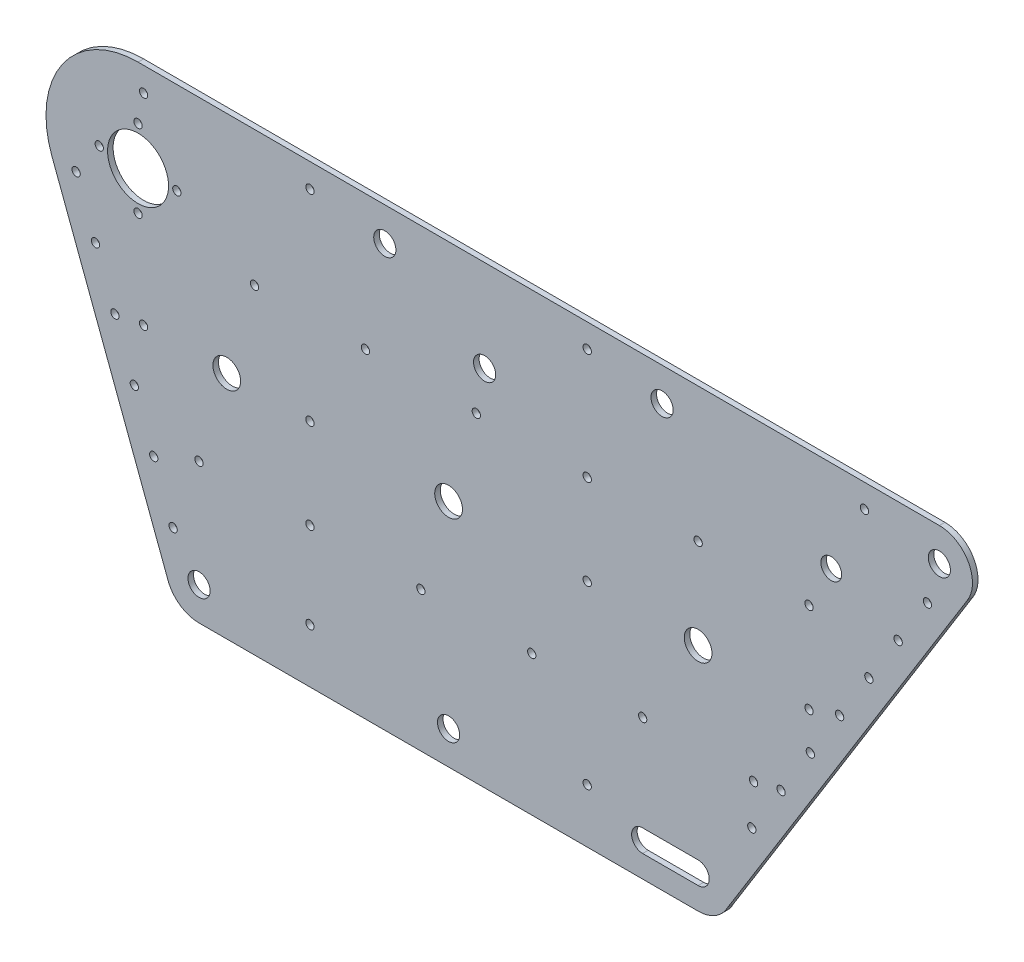
from build123d import *

# Parameters (mm, degrees)
SKETCH2_R             = 3.9998
SKETCH2_R_2           = 1.499925
SKETCH2_R_3           = 4.99975
SKETCH2_R_4           = 3.7498125
SKETCH2_R_5           = 1.5
SKETCH2_R_6           = 10.99945
BOSS_EXTRUDE1_DEPTH   = 1
BODY_MOVE_COPY1_ANGLE = 180


with BuildPart() as part:
    # Sketch2 → Boss-Extrude1 (new, symmetric)
    with BuildSketch(Plane.XY):
        with BuildLine():
            Line((96.362607148, 83.91244893), (182.746139217, -55.124360407))
            ThreePointArc((182.746139217, -55.124360407), (183.120738534, -67.267781048), (172.665833933, -73.456315551))
            Line((172.665833933, -73.456315551), (-116.301106221, -73.709344442))
            ThreePointArc((-116.301106221, -73.709344442), (-143.610306979, -59.428306601), (-147.408355202, -28.84538134))
            Line((-147.408355202, -28.84538134), (-105.239440592, 83.486872373))
            ThreePointArc((-105.239440592, 83.486872373), (-100.811651195, 88.586021375), (-94.331273913, 90.486376541))
            Line((-94.331273913, 90.486376541), (85.638662445, 90.486376541))
            ThreePointArc((85.638662445, 90.486376541), (91.93104468, 88.717175744), (96.362607148, 83.91244893))
        make_face()
        with Locations((-94.331273913, 78.486872372)):
            Circle(SKETCH2_R, mode=Mode.SUBTRACT)
        with Locations((-4.335773913, 78.486872372)):
            Circle(SKETCH2_R, mode=Mode.SUBTRACT)
        with Locations((-54.333273913, 70.986872372)):
            Circle(SKETCH2_R_2, mode=Mode.SUBTRACT)
        with Locations((-103.671855402, 65.368244598)):
            Circle(SKETCH2_R_2, mode=Mode.SUBTRACT)
        with Locations((-110.669996254, 46.632415776)):
            Circle(SKETCH2_R_2, mode=Mode.SUBTRACT)
        with Locations((-94.331273913, 39.98689418)):
            Circle(SKETCH2_R_2, mode=Mode.SUBTRACT)
        with Locations((-117.667881298, 27.897271817)):
            Circle(SKETCH2_R_2, mode=Mode.SUBTRACT)
        with Locations((-114.330273913, 7.486872372)):
            Circle(SKETCH2_R_2, mode=Mode.SUBTRACT)
        with Locations((-124.665791603, 9.162060229)):
            Circle(SKETCH2_R_2, mode=Mode.SUBTRACT)
        with Locations((-131.663765383, -9.573321299)):
            Circle(SKETCH2_R_2, mode=Mode.SUBTRACT)
        with Locations((-116.330173913, -26.513127628)):
            Circle(SKETCH2_R_2, mode=Mode.SUBTRACT)
        with Locations((-138.661805034, -28.308879181)):
            Circle(SKETCH2_R_2, mode=Mode.SUBTRACT)
        with Locations((-130.329473913, -40.513127628)):
            Circle(SKETCH2_R_2, mode=Mode.SUBTRACT)
        with Locations((-102.330873913, -40.513127628)):
            Circle(SKETCH2_R_2, mode=Mode.SUBTRACT)
        with Locations((-114.330273913, -65.013127628)):
            Circle(SKETCH2_R_2, mode=Mode.SUBTRACT)
        with Locations((-116.330173913, -54.513127628)):
            Circle(SKETCH2_R_2, mode=Mode.SUBTRACT)
        with Locations((8.663576087, -40.513127628)):
            Circle(SKETCH2_R, mode=Mode.SUBTRACT)
        with Locations((-54.333273913, -65.013127628)):
            Circle(SKETCH2_R_2, mode=Mode.SUBTRACT)
        with Locations((-27.334544722, -61.513127628)):
            Circle(SKETCH2_R, mode=Mode.SUBTRACT)
        with Locations((-74.332273913, -25.013127628)):
            Circle(SKETCH2_R_2, mode=Mode.SUBTRACT)
        with Locations((-84.331773913, 7.486872372)):
            Circle(SKETCH2_R_3, mode=Mode.SUBTRACT)
        with Locations((-54.333273913, 7.486872372)):
            Circle(SKETCH2_R_2, mode=Mode.SUBTRACT)
        with Locations((-34.334273913, -25.013127628)):
            Circle(SKETCH2_R_2, mode=Mode.SUBTRACT)
        with Locations((-54.333273913, 39.986891336)):
            Circle(SKETCH2_R_2, mode=Mode.SUBTRACT)
        with Locations((-14.335273913, 39.986886595)):
            Circle(SKETCH2_R_2, mode=Mode.SUBTRACT)
        with Locations((-4.335773913, 7.486872372)):
            Circle(SKETCH2_R_3, mode=Mode.SUBTRACT)
        with Locations((5.663726087, -25.013127628)):
            Circle(SKETCH2_R_2, mode=Mode.SUBTRACT)
        with Locations((85.659726087, -25.013127628)):
            Circle(SKETCH2_R_2, mode=Mode.SUBTRACT)
        with Locations((45.661726087, -25.013127628)):
            Circle(SKETCH2_R_2, mode=Mode.SUBTRACT)
        with Locations((45.661726087, 7.486872372)):
            Circle(SKETCH2_R_2, mode=Mode.SUBTRACT)
        with Locations((25.662726087, 39.98688375)):
            Circle(SKETCH2_R_2, mode=Mode.SUBTRACT)
        with Locations((45.661726087, 70.986872372)):
            Circle(SKETCH2_R_2, mode=Mode.SUBTRACT)
        with Locations((65.660726087, 39.986879958)):
            Circle(SKETCH2_R_2, mode=Mode.SUBTRACT)
        with Locations((72.660376087, -61.513127628)):
            Circle(SKETCH2_R, mode=Mode.SUBTRACT)
        with Locations((45.661726087, -65.013127628)):
            Circle(SKETCH2_R_2, mode=Mode.SUBTRACT)
        with Locations((125.657726087, -25.013127628)):
            Circle(SKETCH2_R_2, mode=Mode.SUBTRACT)
        with Locations((133.657326087, -40.513127628)):
            Circle(SKETCH2_R_4, mode=Mode.SUBTRACT)
        with Locations((145.656716219, -65.013127628)):
            Circle(SKETCH2_R_2, mode=Mode.SUBTRACT)
        with Locations((172.655376087, -61.513127628)):
            Circle(SKETCH2_R, mode=Mode.SUBTRACT)
        with Locations((168.349885089, -47.111508591)):
            Circle(SKETCH2_R_2, mode=Mode.SUBTRACT)
        with Locations((157.795381517, -30.123727868)):
            Circle(SKETCH2_R_2, mode=Mode.SUBTRACT)
        with Locations((147.240959183, -13.136077902)):
            Circle(SKETCH2_R_2, mode=Mode.SUBTRACT)
        with Locations((136.686149927, 3.852194828)):
            Circle(SKETCH2_R_2, mode=Mode.SUBTRACT)
        with Locations((125.657726087, 7.486872372)):
            Circle(SKETCH2_R_2, mode=Mode.SUBTRACT)
        with Locations((85.659726087, 7.486872372)):
            Circle(SKETCH2_R_3, mode=Mode.SUBTRACT)
        with Locations((126.131439072, 20.840309178)):
            Circle(SKETCH2_R_2, mode=Mode.SUBTRACT)
        with Locations((115.576938019, 37.828085844)):
            Circle(SKETCH2_R_2, mode=Mode.SUBTRACT)
        with Locations((105.658726087, 39.986878061)):
            Circle(SKETCH2_R_5, mode=Mode.SUBTRACT)
        with Locations((105.022596502, 54.815605735)):
            Circle(SKETCH2_R_2, mode=Mode.SUBTRACT)
        with Locations((-116.330173913, -40.513127628)):
            Circle(SKETCH2_R_6, mode=Mode.SUBTRACT)
        with BuildLine():
            Line((65.660726087, 82.486872372), (85.659726087, 82.486872372))
            ThreePointArc((85.659726087, 82.486872372), (89.659726087, 78.486872372), (85.659726087, 74.486872372))
            Line((85.659726087, 74.486872372), (65.660726087, 74.486872372))
            ThreePointArc((65.660726087, 74.486872372), (61.660726087, 78.486872372), (65.660726087, 82.486872372))
        make_face(mode=Mode.SUBTRACT)
    extrude(amount=BOSS_EXTRUDE1_DEPTH, both=True)


with BuildPart() as part_1:
    # Body-Move/Copy1: moved
    add(part.part.rotate(Axis((0, 8.38851893, 0), (1, 0, 0)), BODY_MOVE_COPY1_ANGLE))


solid = part_1.part
